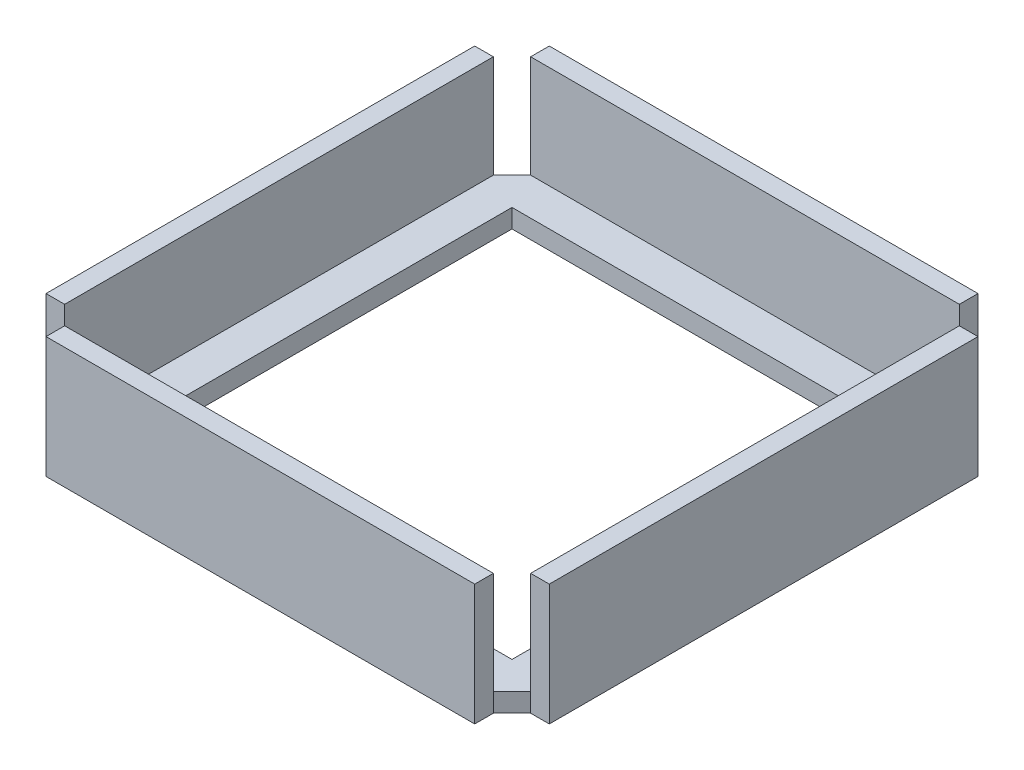
from build123d import *

# Parameters (mm, degrees)
SKETCH1_W           = 42
SKETCH1_H           = 42
BOSS_EXTRUDE3_DEPTH = 2
SKETCH1_26_W        = 46
SKETCH1_26_H        = 2
SKETCH1_26_W_2      = 2
SKETCH1_26_H_2      = 46
BOSS_EXTRUDE6_DEPTH = 13


with BuildPart() as part:
    # Sketch1 → Boss-Extrude3 (new body)
    with BuildSketch(Plane(origin=(0, 0, 0), x_dir=(1, 0, 0), z_dir=(0, 1, 0))):
        Polygon((4, 31), (-42, 31), (-44, 29), (-44, -17), (-42, -19), (4, -19), (6, -17), (6, 29), align=None)
        with Locations((-19, 6)):
            Rectangle(SKETCH1_W, SKETCH1_H, mode=Mode.SUBTRACT)
    extrude(amount=BOSS_EXTRUDE3_DEPTH)

    # Sketch1<26> → Boss-Extrude6 (add)
    with BuildSketch(Plane(origin=(0, 0, 0), x_dir=(1, 0, 0), z_dir=(0, 1, 0))):
        with Locations((-19, 32)):
            Rectangle(SKETCH1_26_W, SKETCH1_26_H)
        with Locations((-45, 6)):
            Rectangle(SKETCH1_26_W_2, SKETCH1_26_H_2)
        with Locations((7, 6)):
            Rectangle(SKETCH1_26_W_2, SKETCH1_26_H_2)
        with Locations((-19, -20)):
            Rectangle(SKETCH1_26_W, SKETCH1_26_H)
    extrude(amount=BOSS_EXTRUDE6_DEPTH)


solid = part.part
